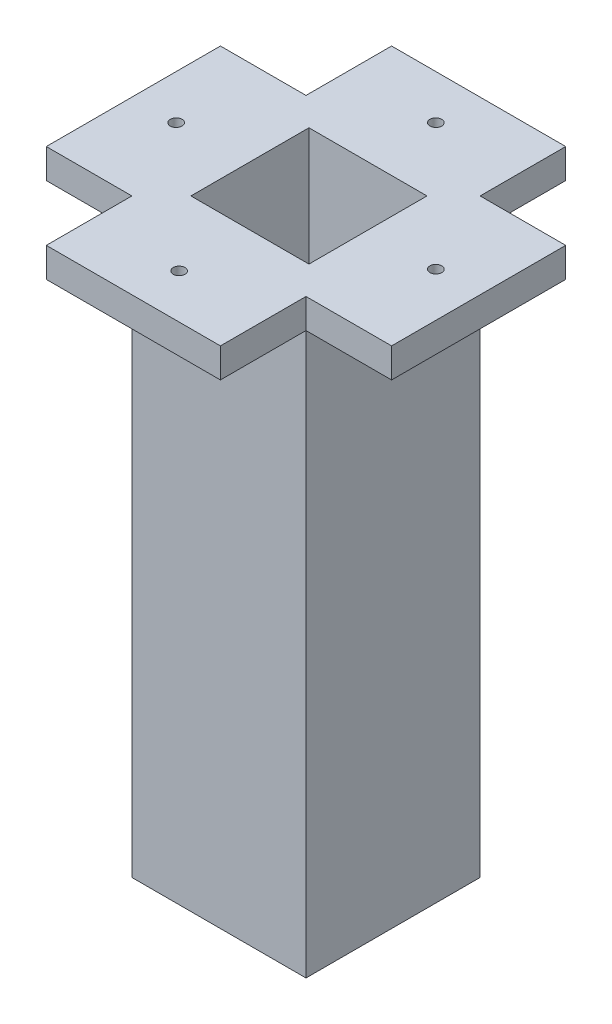
from build123d import *

# Parameters (mm, degrees)
ESQUISSE1_W             = 59
ESQUISSE1_H             = 59
BOSS_EXTRU_1_DEPTH      = 200
ESQUISSE2_W             = 40
ESQUISSE2_H             = 40
ENL_V_MAT_EXTRU_1_DEPTH = 250
ESQUISSE3_W             = 19
ESQUISSE3_H             = 41
ENL_V_MAT_EXTRU_7_DEPTH = 10
ESQUISSE6_R             = 2
ENL_V_MAT_EXTRU_8_DEPTH = 10
ESQUISSE14_W            = 29
ESQUISSE14_H            = 59
ESQUISSE14_W_2          = 59
ESQUISSE14_H_2          = 29
BOSS_EXTRU_3_DEPTH      = 10
ESQUISSE17_R            = 2
ENL_V_MAT_EXTRU_9_DEPTH = 10


with BuildPart() as part:
    # Esquisse1 → Boss.-Extru.1 (new body)
    with BuildSketch(Plane(origin=(0, 0, 0), x_dir=(1, 0, 0), z_dir=(0, 1, 0))):
        with Locations((29.5, 29.5)):
            Rectangle(ESQUISSE1_W, ESQUISSE1_H)
    extrude(amount=BOSS_EXTRU_1_DEPTH)

    # Esquisse2 → Enlèv. mat.-Extru.1 (cut)
    with BuildSketch(Plane(origin=(0, 200, 0), x_dir=(1, 0, 0), z_dir=(0, 1, 0))):
        with Locations((30, 30)):
            Rectangle(ESQUISSE2_W, ESQUISSE2_H)
    extrude(amount=-ENL_V_MAT_EXTRU_1_DEPTH, mode=Mode.SUBTRACT)

    # Esquisse3 → Enlèv. mat.-Extru.7 (cut)
    with BuildSketch(Plane(origin=(0, 0, 0), x_dir=(0, 0, -1), z_dir=(1, 0, 0))):
        with Locations((29.5, 99.5)):
            Rectangle(ESQUISSE3_W, ESQUISSE3_H)
    extrude(amount=ENL_V_MAT_EXTRU_7_DEPTH, mode=Mode.SUBTRACT)

    # Esquisse6 → Enlèv. mat.-Extru.8 (cut)
    with BuildSketch(Plane.ZY):
        with Locations((-33.5, 123.5)):
            Circle(ESQUISSE6_R)
        with Locations((-25.5, 123.5)):
            Circle(ESQUISSE6_R)
        with Locations((-33.5, 75.5)):
            Circle(ESQUISSE6_R)
        with Locations((-25.5, 75.5)):
            Circle(ESQUISSE6_R)
    extrude(amount=-ENL_V_MAT_EXTRU_8_DEPTH, mode=Mode.SUBTRACT)

    # Esquisse14 → Boss.-Extru.3 (add)
    with BuildSketch(Plane(origin=(0, 200, 0), x_dir=(1, 0, 0), z_dir=(0, 1, 0))):
        with Locations((73.5, 29.5)):
            Rectangle(ESQUISSE14_W, ESQUISSE14_H)
        with Locations((29.5, -14.5)):
            Rectangle(ESQUISSE14_W_2, ESQUISSE14_H_2)
        with Locations((-14.5, 29.5)):
            Rectangle(ESQUISSE14_W, ESQUISSE14_H)
        with Locations((29.5, 73.5)):
            Rectangle(ESQUISSE14_W_2, ESQUISSE14_H_2)
    extrude(amount=-BOSS_EXTRU_3_DEPTH)

    # Esquisse17 → Enlèv. mat.-Extru.9 (cut)
    with BuildSketch(Plane(origin=(0, 190, 0), x_dir=(-1, 0, 0), z_dir=(0, -1, 0))):
        with Locations(Location((-73, 30, 0), (0, 0, 90))):
            Circle(ESQUISSE17_R)
        with Locations(Location((-30, -14, 0), (0, 0, 90))):
            Circle(ESQUISSE17_R)
        with Locations(Location((14, 29, 0), (0, 0, 90))):
            Circle(ESQUISSE17_R)
        with Locations(Location((-30, 73, 0), (0, 0, 90))):
            Circle(ESQUISSE17_R)
    extrude(amount=-ENL_V_MAT_EXTRU_9_DEPTH, mode=Mode.SUBTRACT)


solid = part.part
